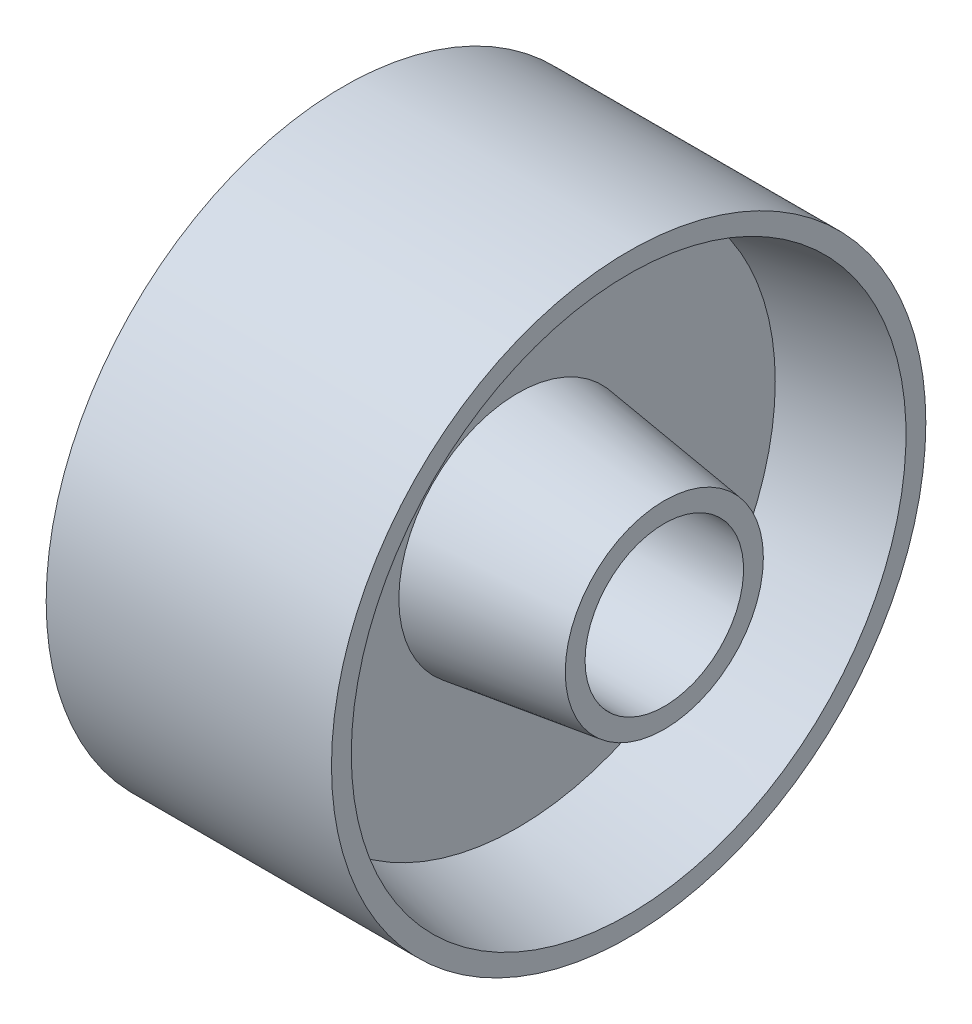
from build123d import *


with BuildPart() as part:
    # Sketch1 → Revolve2 (revolve)
    with BuildSketch(Plane.XY, mode=Mode.PRIVATE) as revolve2_sk:
        Polygon((-36, 75), (36, 75), (36, 70), (8, 65), (8, 30), (45, 25), (45, 20), (-45, 20), (-45, 25), (-8, 30), (-8, 65), (-36, 70), align=None)
    revolve(revolve2_sk.sketch.rotate(Axis((0, 0, 0), (1, 0, 0)), 90), axis=Axis((0, 0, 0), (1, 0, 0)))


solid = part.part
